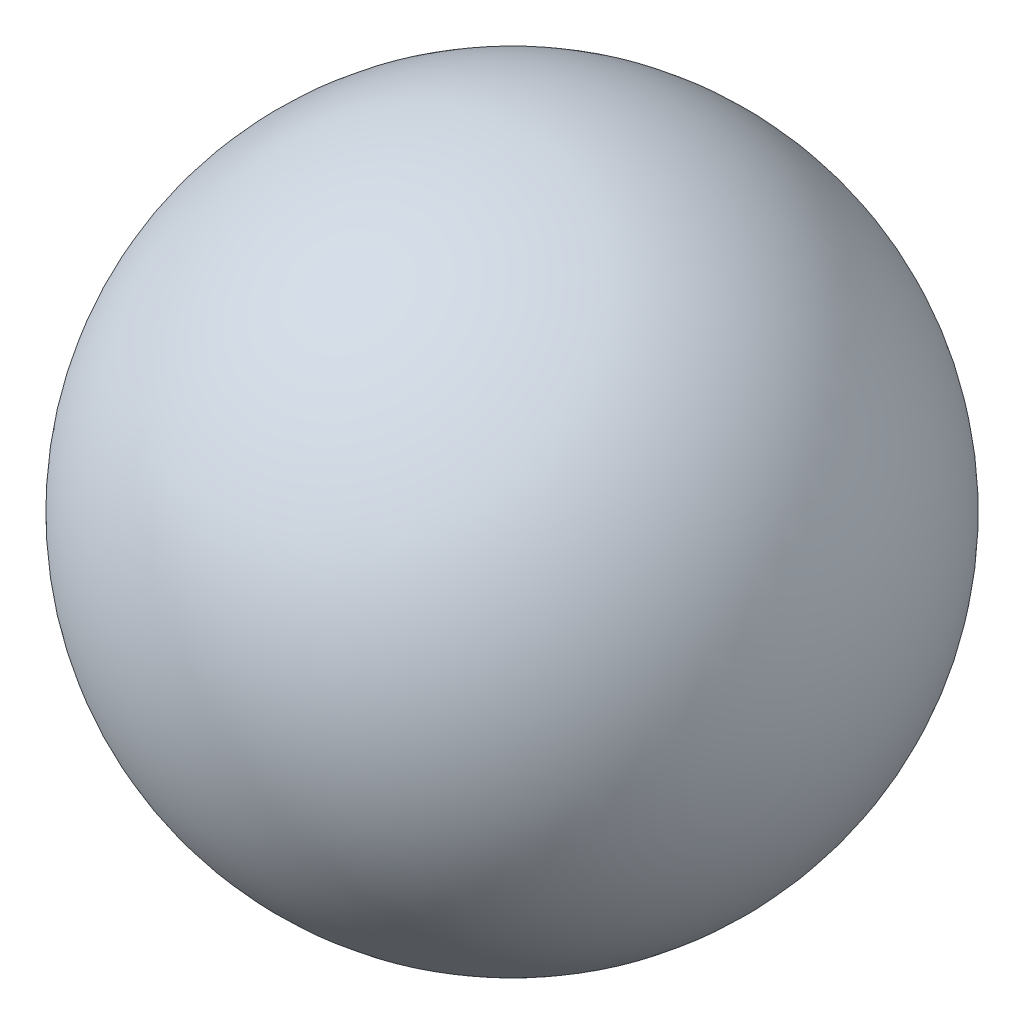
from build123d import *


with BuildPart() as part:
    # 草图1 → 旋转1 (revolve)
    with BuildSketch(Plane.XY):
        with BuildLine():
            Line((0, 105), (0, -105))
            ThreePointArc((0, -105), (105, 0), (0, 105))
        make_face()
    revolve(axis=Axis((0, 296.35563177, 0), (0, -1, 0)))


solid = part.part
